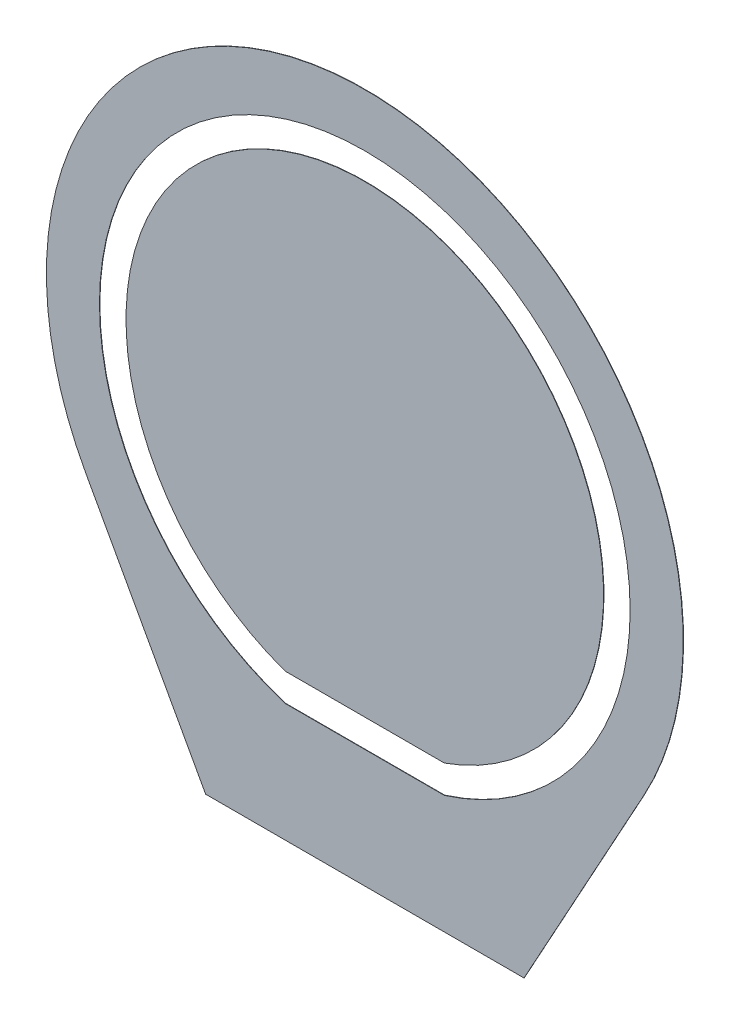
from build123d import *

# Parameters (mm, degrees)
BOSS_EXTRUDE1_DEPTH   = 0.03556
BOSS_EXTRUDE1_2_DEPTH = 0.03556


with BuildPart() as part:
    # Sketch1 → Boss-Extrude1 (new body)
    with BuildSketch(Plane.XY):
        with BuildLine():
            Line((-7.500000004, -21.213203434), (7.500000004, -21.213203434))
            ThreePointArc((7.500000004, -21.213203434), (0, 22.5), (-7.500000004, -21.213203434))
        make_face()
    extrude(amount=BOSS_EXTRUDE1_DEPTH)


with BuildPart() as body_2:
    # Sketch1 → Boss-Extrude1 2 (new body)
    with BuildSketch(Plane.XY):
        with BuildLine():
            Line((-15, -35.000000034), (15, -35.000000034))
            Line((15, -35.000000034), (26.292884658, -14.445906561))
            ThreePointArc((26.292884658, -14.445906561), (0, 30), (-26.292884658, -14.445906561))
            Line((-26.292884658, -14.445906561), (-15, -35.000000034))
        make_face()
        with BuildLine():
            Line((-7.500000004, -23.848480034), (7.500000004, -23.848480034))
            ThreePointArc((7.500000004, -23.848480034), (0, 25), (-7.500000004, -23.848480034))
        make_face(mode=Mode.SUBTRACT)
    extrude(amount=BOSS_EXTRUDE1_2_DEPTH)


solid = Compound([part.part, body_2.part])
